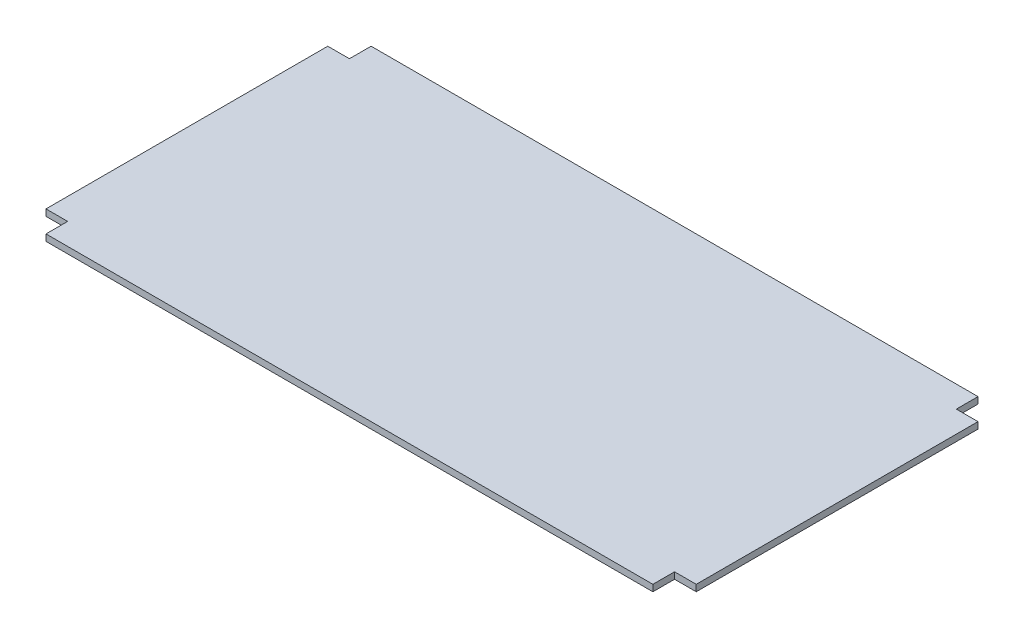
from build123d import *

# Parameters (mm, degrees)
SZKIC1_W                    = 600
SZKIC1_H                    = 300
DODANIE_WYCI_GNI_CIE1_DEPTH = 6
SZKIC2_W                    = 20
SZKIC2_H                    = 20
WYTNIJ_WYCI_GNI_CIE1_DEPTH  = 671.847225529


with BuildPart() as part:
    # Szkic1 → Dodanie-wyciągnięcie1 (new body)
    with BuildSketch(Plane(origin=(0, 0, 0), x_dir=(1, 0, 0), z_dir=(0, 1, 0))):
        with Locations((300, 150)):
            Rectangle(SZKIC1_W, SZKIC1_H)
    extrude(amount=DODANIE_WYCI_GNI_CIE1_DEPTH)

    # Szkic2 → Wytnij-wyciągnięcie1 (cut, through all)
    with BuildSketch(Plane(origin=(0, 6, 0), x_dir=(1, 0, 0), z_dir=(0, 1, 0))):
        with Locations((590, 10)):
            Rectangle(SZKIC2_W, SZKIC2_H)
        with Locations((10, 10)):
            Rectangle(SZKIC2_W, SZKIC2_H)
        with Locations((590, 290)):
            Rectangle(SZKIC2_W, SZKIC2_H)
        with Locations((10, 290)):
            Rectangle(SZKIC2_W, SZKIC2_H)
    extrude(amount=-WYTNIJ_WYCI_GNI_CIE1_DEPTH, mode=Mode.SUBTRACT)


solid = part.part
